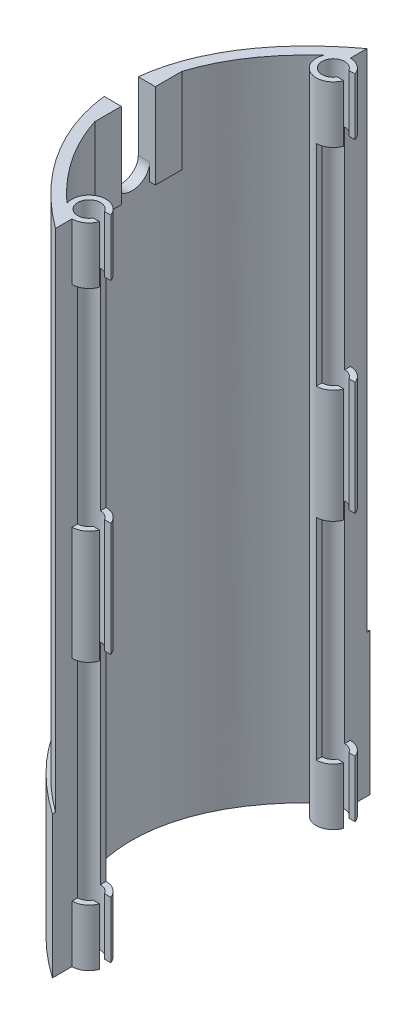
from build123d import *

# Parameters (mm, degrees)
EXTRUDE_1_DEPTH          = 114
EXTRUDE_2_DEPTH          = 25
CUT_EXTRUDE_1_DEPTH      = 136.153981133
SKETCH_4_W               = 1
SKETCH_4_H               = 5
EXTRUDE_3_DEPTH          = 15
CUT_EXTRUDE_2_DEPTH      = 136.153981133
CUT_EXTRUDE_2_DEPTH_BACK = 136.153981133
SKETCH_5_W               = 9.764805651
SKETCH_5_H               = 37


with BuildPart() as part:
    # 草图1 → 凸台-拉伸1 (new body)
    with BuildSketch(Plane(origin=(0, 0, 0), x_dir=(1, 0, 0), z_dir=(0, 1, 0))):
        with BuildLine():
            Line((-50, 27.415384473), (-50, 24.5))
            ThreePointArc((-50, 24.5), (-48.267949192, 23.949489743), (-47.171572875, 22.5))
            Line((-47.171572875, 22.5), (-48.267949192, 22.5))
            ThreePointArc((-48.267949192, 22.5), (-52, 21.5), (-48.267949192, 20.5))
            Line((-48.267949192, 20.5), (-47.171572875, 20.5))
            ThreePointArc((-47.171572875, 20.5), (-51.060822526, 18.693818329), (-52.782628461, 22.62115068))
            add(Edge.make_bspline(
                [(-52.782628461, 22.62115068), (-77.601288898, 0), (-52.782628461, -22.62115068)],
                knots=[5.682111054, 5.682111054, 5.682111054, 6.884259561, 6.884259561, 6.884259561], degree=2, weights=[1, 0.82472857, 1]))
            ThreePointArc((-52.782628461, -22.62115068), (-51.060822526, -18.693818329), (-47.171572875, -20.5))
            Line((-47.171572875, -20.5), (-48.267949192, -20.5))
            ThreePointArc((-48.267949192, -20.5), (-52, -21.5), (-48.267949192, -22.5))
            Line((-48.267949192, -22.5), (-47.171572875, -22.5))
            ThreePointArc((-47.171572875, -22.5), (-48.267949192, -23.949489743), (-50, -24.5))
            Line((-50, -24.5), (-50, -27.415384473))
            add(Edge.make_bspline(
                [(-50, 27.415384473), (-87.12, 0), (-50, -27.415384473)],
                knots=[2.430387488, 2.430387488, 2.430387488, 3.85279782, 3.85279782, 3.85279782], degree=2, weights=[1, 0.757575758, 1]))
        make_face()
    extrude(amount=EXTRUDE_1_DEPTH)

    # 草图2 → 凸台-拉伸2 (add)
    with BuildSketch(Plane.XZ):
        with BuildLine():
            Line((-50, -24.968730444), (-50, -27.95708451))
            add(Edge.make_bspline(
                [(-50, 27.95708451), (-89.78, 0), (-50, -27.95708451)],
                knots=[5.554827697, 5.554827697, 5.554827697, 7.011542917, 7.011542917, 7.011542917], degree=2, weights=[1, 0.746268657, 1]))
            Line((-50, 27.95708451), (-50, 24.968730444))
            add(Edge.make_bspline(
                [(-50, 24.968730444), (-81.92, 0), (-50, -24.968730444)],
                knots=[5.609054801, 5.609054801, 5.609054801, 6.957315814, 6.957315814, 6.957315814], degree=2, weights=[1, 0.78125, 1]))
        make_face()
    extrude(amount=-EXTRUDE_2_DEPTH)

    # 草图3 → 切除-拉伸1 (cut, through all)
    with BuildSketch(Plane(origin=(0, 0, 0), x_dir=(0, 0, -1), z_dir=(1, 0, 0))):
        with BuildLine():
            Line((3, 114), (-3, 114))
            Line((-3, 114), (-3, 102))
            ThreePointArc((-3, 102), (0, 99), (3, 102))
            Line((3, 102), (3, 114))
        make_face()
    extrude(amount=-CUT_EXTRUDE_1_DEPTH, mode=Mode.SUBTRACT)

    # 草图4 → 凸台-拉伸3 (add)
    with BuildSketch(Plane(origin=(0, 114, 0), x_dir=(1, 0, 0), z_dir=(0, 1, 0))):
        with Locations((-63.319746161, 5.5)):
            Rectangle(SKETCH_4_W, SKETCH_4_H)
        with Locations((-63.319746161, -5.5)):
            Rectangle(SKETCH_4_W, SKETCH_4_H)
    extrude(amount=-EXTRUDE_3_DEPTH)

    # 草图5 → 切除-拉伸2 (cut, two sides: drawn at the far end of the back side and taken through both)
    with BuildSketch(Plane.XY.offset(-CUT_EXTRUDE_2_DEPTH_BACK)):
        with Locations((-45.117597175, 85.5)):
            Rectangle(SKETCH_5_W, SKETCH_5_H)
        with Locations((-45.117597175, 28.5)):
            Rectangle(SKETCH_5_W, SKETCH_5_H)
    extrude(amount=CUT_EXTRUDE_2_DEPTH + CUT_EXTRUDE_2_DEPTH_BACK, mode=Mode.SUBTRACT)


solid = part.part
